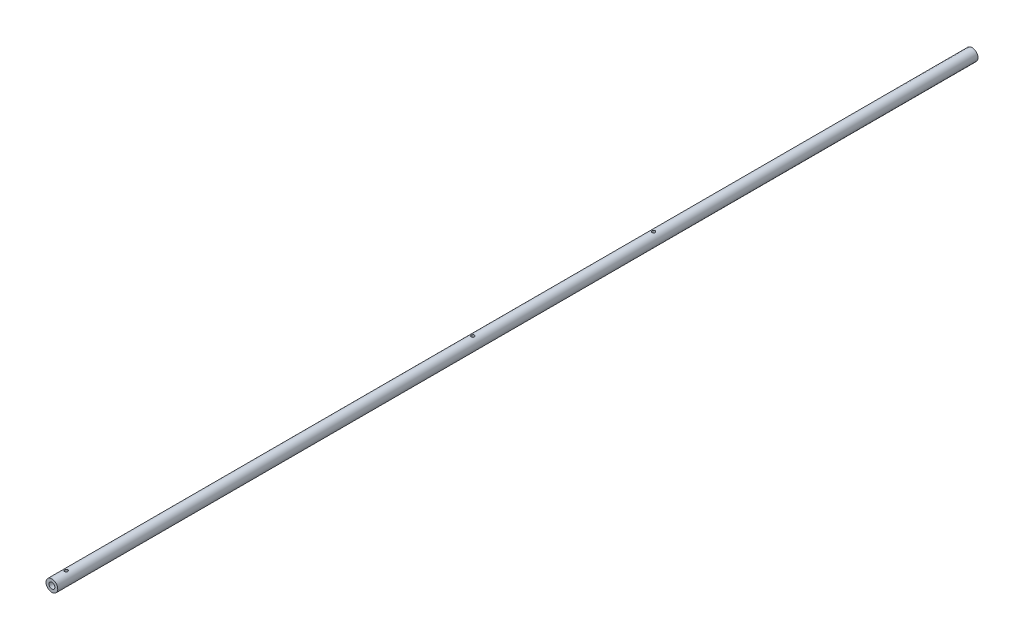
from build123d import *

# Parameters (mm, degrees)
SKETCH1_R        = 7.8613
SKETCH1_R_2      = 3.93065
ROD_DEPTH        = 1228.725
HOLES_DEPTH      = 1229.77529504
HOLES_DEPTH_BACK = 1229.77529504
SKETCH3_R        = 2.1082


with BuildPart() as part:
    # Sketch1 → Rod (new body)
    with BuildSketch(Plane.XY):
        Circle(SKETCH1_R)
        Circle(SKETCH1_R_2, mode=Mode.SUBTRACT)
    extrude(amount=ROD_DEPTH)

    # Sketch3 → Holes (cut, two sides: drawn at the far end of the back side and taken through both)
    with BuildSketch(Plane(origin=(0, 0, 0), x_dir=(1, 0, 0), z_dir=(0, 1, 0)).offset(-HOLES_DEPTH_BACK)):
        with Locations(Location((0, -425.45, 0), (0, 0, 270))):
            Circle(SKETCH3_R)
        with Locations(Location((0, -666.75, 0), (0, 0, 270))):
            Circle(SKETCH3_R)
        with Locations(Location((0, -1209.675, 0), (0, 0, 270))):
            Circle(SKETCH3_R)
    extrude(amount=HOLES_DEPTH + HOLES_DEPTH_BACK, mode=Mode.SUBTRACT)


solid = part.part
